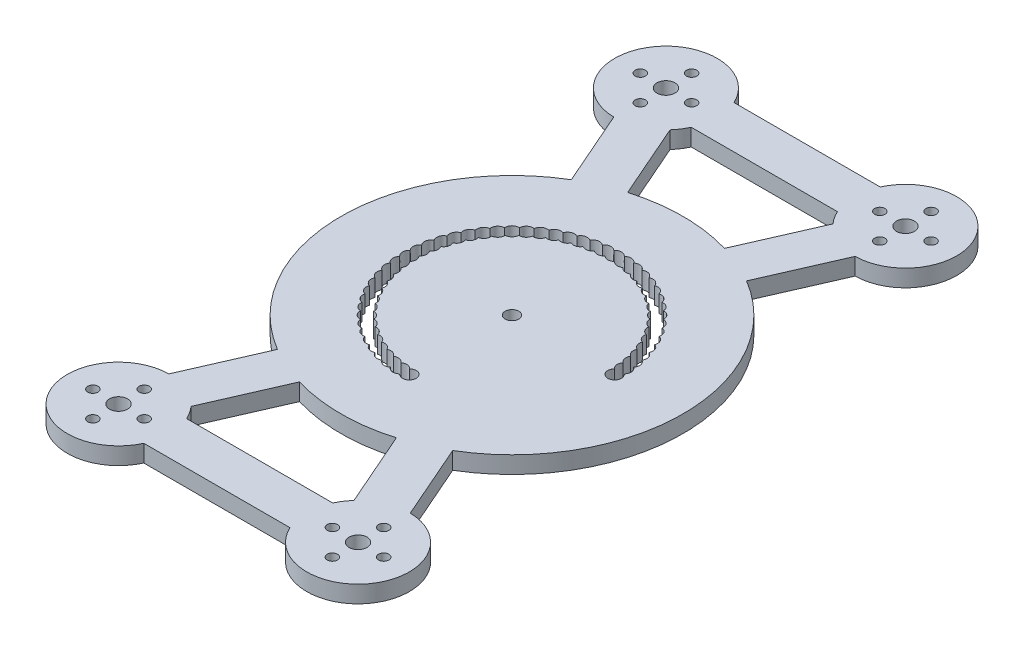
from build123d import *

# Parameters (mm, degrees)
SKETCH1_W           = 100
SKETCH1_H           = 190
BOSS_EXTRUDE1_DEPTH = 5
SKETCH2_R           = 2
CUT_EXTRUDE1_DEPTH  = 108.470926301
SKETCH3_OUTSIDE_W   = 144.954
SKETCH3_OUTSIDE_H   = 234.954
SKETCH3_OUTSIDE_R   = 2.625
SKETCH3_OUTSIDE_R_2 = 1.5
CUT_EXTRUDE2_DEPTH  = 108.470926301


with BuildPart() as part:
    # Sketch1 → Boss-Extrude1 (new body)
    with BuildSketch(Plane(origin=(0, 0, 0), x_dir=(1, 0, 0), z_dir=(0, 1, 0))):
        Rectangle(SKETCH1_W, SKETCH1_H)
    extrude(amount=BOSS_EXTRUDE1_DEPTH)

    # Sketch2 → Cut-Extrude1 (cut, through all)
    with BuildSketch(Plane(origin=(0, 5, 0), x_dir=(1, 0, 0), z_dir=(0, 1, 0))):
        with Locations(Location((0, 0, 0), (0, 0, 270))):
            Circle(SKETCH2_R)
        with BuildLine():
            ThreePointArc((28.575471562, 1.403822899), (30.098135349, -1.997590912), (31.280070238, 1.536691311))
            ThreePointArc((31.280070238, 1.536691311), (31.845911254, 3.136548491), (30.978826062, 4.595274757))
            ThreePointArc((30.978826062, 4.595274757), (31.385128973, 6.242890305), (30.379238856, 7.609603194))
            ThreePointArc((30.379238856, 7.609603194), (30.622090743, 9.289109672), (29.487082974, 10.550646993))
            ThreePointArc((29.487082974, 10.550646993), (29.56414504, 12.245869836), (28.310950363, 13.390082294))
            ThreePointArc((28.310950363, 13.390082294), (28.221480459, 15.084695578), (26.862167823, 16.100563782))
            ThreePointArc((26.862167823, 16.100563782), (26.607027594, 17.778247457), (25.154687923, 18.65598804))
            ThreePointArc((25.154687923, 18.65598804), (24.736334508, 20.300585093), (23.204954628, 21.031744934))
            ThreePointArc((23.204954628, 21.031744934), (22.627416998, 22.627416998), (21.031744934, 23.204954628))
            ThreePointArc((21.031744934, 23.204954628), (20.300585093, 24.736334508), (18.65598804, 25.154687923))
            ThreePointArc((18.65598804, 25.154687923), (17.778247457, 26.607027594), (16.100563782, 26.862167823))
            ThreePointArc((16.100563782, 26.862167823), (15.084695578, 28.221480459), (13.390082294, 28.310950363))
            ThreePointArc((13.390082294, 28.310950363), (12.245869836, 29.56414504), (10.550646993, 29.487082974))
            ThreePointArc((10.550646993, 29.487082974), (9.289109672, 30.622090743), (7.609603194, 30.379238856))
            ThreePointArc((7.609603194, 30.379238856), (6.242890305, 31.385128973), (4.595274757, 30.978826062))
            ThreePointArc((4.595274757, 30.978826062), (3.136548491, 31.845911254), (1.536691311, 31.280070238))
            ThreePointArc((1.536691311, 31.280070238), (0, 32), (-1.536691311, 31.280070238))
            ThreePointArc((-1.536691311, 31.280070238), (-3.136548491, 31.845911254), (-4.595274757, 30.978826062))
            ThreePointArc((-4.595274757, 30.978826062), (-6.242890305, 31.385128973), (-7.609603194, 30.379238856))
            ThreePointArc((-7.609603194, 30.379238856), (-9.289109672, 30.622090743), (-10.550646993, 29.487082974))
            ThreePointArc((-10.550646993, 29.487082974), (-12.245869836, 29.56414504), (-13.390082294, 28.310950363))
            ThreePointArc((-13.390082294, 28.310950363), (-15.084695578, 28.221480459), (-16.100563782, 26.862167823))
            ThreePointArc((-16.100563782, 26.862167823), (-17.778247457, 26.607027594), (-18.65598804, 25.154687923))
            ThreePointArc((-18.65598804, 25.154687923), (-20.300585093, 24.736334508), (-21.031744934, 23.204954628))
            ThreePointArc((-21.031744934, 23.204954628), (-22.627416998, 22.627416998), (-23.204954628, 21.031744934))
            ThreePointArc((-23.204954628, 21.031744934), (-24.736334508, 20.300585093), (-25.154687923, 18.65598804))
            ThreePointArc((-25.154687923, 18.65598804), (-26.607027594, 17.778247457), (-26.862167823, 16.100563782))
            ThreePointArc((-26.862167823, 16.100563782), (-28.221480459, 15.084695578), (-28.310950363, 13.390082294))
            ThreePointArc((-28.310950363, 13.390082294), (-29.56414504, 12.245869836), (-29.487082974, 10.550646993))
            ThreePointArc((-29.487082974, 10.550646993), (-30.622090743, 9.289109672), (-30.379238856, 7.609603194))
            ThreePointArc((-30.379238856, 7.609603194), (-31.385128973, 6.242890305), (-30.978826062, 4.595274757))
            ThreePointArc((-30.978826062, 4.595274757), (-31.845911254, 3.136548491), (-31.280070238, 1.536691311))
            ThreePointArc((-31.280070238, 1.536691311), (-32, 0), (-31.280070238, -1.536691311))
            ThreePointArc((-31.280070238, -1.536691311), (-31.845911254, -3.136548491), (-30.978826062, -4.595274757))
            ThreePointArc((-30.978826062, -4.595274757), (-31.385128973, -6.242890305), (-30.379238856, -7.609603194))
            ThreePointArc((-30.379238856, -7.609603194), (-30.622090743, -9.289109672), (-29.487082974, -10.550646993))
            ThreePointArc((-29.487082974, -10.550646993), (-29.56414504, -12.245869836), (-28.310950363, -13.390082294))
            ThreePointArc((-28.310950363, -13.390082294), (-28.221480459, -15.084695578), (-26.862167823, -16.100563782))
            ThreePointArc((-26.862167823, -16.100563782), (-26.607027594, -17.778247457), (-25.154687923, -18.65598804))
            ThreePointArc((-25.154687923, -18.65598804), (-24.736334508, -20.300585093), (-23.204954628, -21.031744934))
            ThreePointArc((-23.204954628, -21.031744934), (-22.627416998, -22.627416998), (-21.031744934, -23.204954628))
            ThreePointArc((-21.031744934, -23.204954628), (-20.300585093, -24.736334508), (-18.65598804, -25.154687923))
            ThreePointArc((-18.65598804, -25.154687923), (-17.778247457, -26.607027594), (-16.100563782, -26.862167823))
            ThreePointArc((-16.100563782, -26.862167823), (-15.084695578, -28.221480459), (-13.390082294, -28.310950363))
            ThreePointArc((-13.390082294, -28.310950363), (-12.245869836, -29.56414504), (-10.550646993, -29.487082974))
            ThreePointArc((-10.550646993, -29.487082974), (-9.289109672, -30.622090743), (-7.609603194, -30.379238856))
            ThreePointArc((-7.609603194, -30.379238856), (-6.242890305, -31.385128973), (-4.595274757, -30.978826062))
            ThreePointArc((-4.595274757, -30.978826062), (-3.136548491, -31.845911254), (-1.536691311, -31.280070238))
            ThreePointArc((-1.536691311, -31.280070238), (1.997590912, -30.098135349), (-1.403822899, -28.575471562))
            ThreePointArc((-1.403822899, -28.575471562), (-2.744479929, -27.865172347), (-4.197949114, -28.30027415))
            ThreePointArc((-4.197949114, -28.30027415), (-5.462529016, -27.461987851), (-6.951646784, -27.752529628))
            ThreePointArc((-6.951646784, -27.752529628), (-8.127970963, -26.794329401), (-9.638396296, -26.937513074))
            ThreePointArc((-9.638396296, -26.937513074), (-10.715136106, -25.86862691), (-12.232322782, -25.863073543))
            ThreePointArc((-12.232322782, -25.863073543), (-13.199108631, -24.693795402), (-14.708445313, -24.539558476))
            ThreePointArc((-14.708445313, -24.539558476), (-15.555966525, -23.281149144), (-17.042917476, -22.979714046))
            ThreePointArc((-17.042917476, -22.979714046), (-17.763011957, -21.644292694), (-19.213257026, -21.198562409))
            ThreePointArc((-19.213257026, -21.198562409), (-19.798989873, -19.798989873), (-21.198562409, -19.213257026))
            ThreePointArc((-21.198562409, -19.213257026), (-21.644292694, -17.763011957), (-22.979714046, -17.042917476))
            ThreePointArc((-22.979714046, -17.042917476), (-23.281149144, -15.555966525), (-24.539558476, -14.708445313))
            ThreePointArc((-24.539558476, -14.708445313), (-24.693795402, -13.199108631), (-25.863073543, -12.232322782))
            ThreePointArc((-25.863073543, -12.232322782), (-25.86862691, -10.715136106), (-26.937513074, -9.638396296))
            ThreePointArc((-26.937513074, -9.638396296), (-26.794329401, -8.127970963), (-27.752529628, -6.951646784))
            ThreePointArc((-27.752529628, -6.951646784), (-27.461987851, -5.462529016), (-28.30027415, -4.197949114))
            ThreePointArc((-28.30027415, -4.197949114), (-27.865172347, -2.744479929), (-28.575471562, -1.403822899))
            ThreePointArc((-28.575471562, -1.403822899), (-28, 0), (-28.575471562, 1.403822899))
            ThreePointArc((-28.575471562, 1.403822899), (-27.865172347, 2.744479929), (-28.30027415, 4.197949114))
            ThreePointArc((-28.30027415, 4.197949114), (-27.461987851, 5.462529016), (-27.752529628, 6.951646784))
            ThreePointArc((-27.752529628, 6.951646784), (-26.794329401, 8.127970963), (-26.937513074, 9.638396296))
            ThreePointArc((-26.937513074, 9.638396296), (-25.86862691, 10.715136106), (-25.863073543, 12.232322782))
            ThreePointArc((-25.863073543, 12.232322782), (-24.693795402, 13.199108631), (-24.539558476, 14.708445313))
            ThreePointArc((-24.539558476, 14.708445313), (-23.281149144, 15.555966525), (-22.979714046, 17.042917476))
            ThreePointArc((-22.979714046, 17.042917476), (-21.644292694, 17.763011957), (-21.198562409, 19.213257026))
            ThreePointArc((-21.198562409, 19.213257026), (-19.798989873, 19.798989873), (-19.213257026, 21.198562409))
            ThreePointArc((-19.213257026, 21.198562409), (-17.763011957, 21.644292694), (-17.042917476, 22.979714046))
            ThreePointArc((-17.042917476, 22.979714046), (-15.555966525, 23.281149144), (-14.708445313, 24.539558476))
            ThreePointArc((-14.708445313, 24.539558476), (-13.199108631, 24.693795402), (-12.232322782, 25.863073543))
            ThreePointArc((-12.232322782, 25.863073543), (-10.715136106, 25.86862691), (-9.638396296, 26.937513074))
            ThreePointArc((-9.638396296, 26.937513074), (-8.127970963, 26.794329401), (-6.951646784, 27.752529628))
            ThreePointArc((-6.951646784, 27.752529628), (-5.462529016, 27.461987851), (-4.197949114, 28.30027415))
            ThreePointArc((-4.197949114, 28.30027415), (-2.744479929, 27.865172347), (-1.403822899, 28.575471562))
            ThreePointArc((-1.403822899, 28.575471562), (0, 28), (1.403822899, 28.575471562))
            ThreePointArc((1.403822899, 28.575471562), (2.744479929, 27.865172347), (4.197949114, 28.30027415))
            ThreePointArc((4.197949114, 28.30027415), (5.462529016, 27.461987851), (6.951646784, 27.752529628))
            ThreePointArc((6.951646784, 27.752529628), (8.127970963, 26.794329401), (9.638396296, 26.937513074))
            ThreePointArc((9.638396296, 26.937513074), (10.715136106, 25.86862691), (12.232322782, 25.863073543))
            ThreePointArc((12.232322782, 25.863073543), (13.199108631, 24.693795402), (14.708445313, 24.539558476))
            ThreePointArc((14.708445313, 24.539558476), (15.555966525, 23.281149144), (17.042917476, 22.979714046))
            ThreePointArc((17.042917476, 22.979714046), (17.763011957, 21.644292694), (19.213257026, 21.198562409))
            ThreePointArc((19.213257026, 21.198562409), (19.798989873, 19.798989873), (21.198562409, 19.213257026))
            ThreePointArc((21.198562409, 19.213257026), (21.644292694, 17.763011957), (22.979714046, 17.042917476))
            ThreePointArc((22.979714046, 17.042917476), (23.281149144, 15.555966525), (24.539558476, 14.708445313))
            ThreePointArc((24.539558476, 14.708445313), (24.693795402, 13.199108631), (25.863073543, 12.232322782))
            ThreePointArc((25.863073543, 12.232322782), (25.86862691, 10.715136106), (26.937513074, 9.638396296))
            ThreePointArc((26.937513074, 9.638396296), (26.794329401, 8.127970963), (27.752529628, 6.951646784))
            ThreePointArc((27.752529628, 6.951646784), (27.461987851, 5.462529016), (28.30027415, 4.197949114))
            ThreePointArc((28.30027415, 4.197949114), (27.865172347, 2.744479929), (28.575471562, 1.403822899))
        make_face()
    extrude(amount=-CUT_EXTRUDE1_DEPTH, mode=Mode.SUBTRACT)

    # Sketch3 outside → Cut-Extrude2 (cut, through all)
    # profile 1 of 23: a face of its own
    with BuildSketch(Plane(origin=(0, 5, 0), x_dir=(1, 0, 0), z_dir=(0, 1, 0))):
        Rectangle(SKETCH3_OUTSIDE_W, SKETCH3_OUTSIDE_H)
        with BuildLine():
            Line((-35.260461755, 65.002261515), (-25.609738761, 42.943466099))
            ThreePointArc((-25.609738761, 42.943466099), (-50, 0), (-25.609738761, -42.943466099))
            Line((-25.609738761, -42.943466099), (-35.260461755, -65.002261515))
            ThreePointArc((-35.260461755, -65.002261515), (-47.553569963, -88.210230275), (-21.364109857, -86.25))
            Line((-21.364109857, -86.25), (21.364109857, -86.25))
            ThreePointArc((21.364109857, -86.25), (47.553569963, -88.210230275), (35.260461755, -65.002261515))
            Line((35.260461755, -65.002261515), (25.609738761, -42.943466099))
            ThreePointArc((25.609738761, -42.943466099), (50, 0), (25.609738761, 42.943466099))
            Line((25.609738761, 42.943466099), (35.260461755, 65.002261515))
            ThreePointArc((35.260461755, 65.002261515), (47.553569963, 88.210230275), (21.364109857, 86.25))
            Line((21.364109857, 86.25), (-21.364109857, 86.25))
            ThreePointArc((-21.364109857, 86.25), (-47.553569963, 88.210230275), (-35.260461755, 65.002261515))
        make_face(mode=Mode.SUBTRACT)
    # profile 2 of 23: a face of its own
    with BuildSketch(Plane(origin=(0, 5, 0), x_dir=(1, 0, 0), z_dir=(0, 1, 0))):
        with Locations(Location((-35, 80, 0), (0, 0, 270))):
            Circle(SKETCH3_OUTSIDE_R)
    # profile 3 of 23: a face of its own
    with BuildSketch(Plane(origin=(0, 5, 0), x_dir=(1, 0, 0), z_dir=(0, 1, 0))):
        with Locations(Location((-35, 87.5, 0), (0, 0, 270))):
            Circle(SKETCH3_OUTSIDE_R_2)
    # profile 4 of 23: a face of its own
    with BuildSketch(Plane(origin=(0, 5, 0), x_dir=(1, 0, 0), z_dir=(0, 1, 0))):
        with Locations(Location((-27.5, 80, 0), (0, 0, 270))):
            Circle(SKETCH3_OUTSIDE_R_2)
    # profile 5 of 23: a face of its own
    with BuildSketch(Plane(origin=(0, 5, 0), x_dir=(1, 0, 0), z_dir=(0, 1, 0))):
        with Locations(Location((-35, 72.5, 0), (0, 0, 270))):
            Circle(SKETCH3_OUTSIDE_R_2)
    # profile 6 of 23: a face of its own
    with BuildSketch(Plane(origin=(0, 5, 0), x_dir=(1, 0, 0), z_dir=(0, 1, 0))):
        with Locations(Location((-42.5, 80, 0), (0, 0, 270))):
            Circle(SKETCH3_OUTSIDE_R_2)
    # profile 7 of 23: a face of its own
    with BuildSketch(Plane(origin=(0, 5, 0), x_dir=(1, 0, 0), z_dir=(0, 1, 0))):
        with Locations(Location((35, 72.5, 0), (0, 0, 90))):
            Circle(SKETCH3_OUTSIDE_R_2)
    # profile 8 of 23: a face of its own
    with BuildSketch(Plane(origin=(0, 5, 0), x_dir=(1, 0, 0), z_dir=(0, 1, 0))):
        with Locations(Location((42.5, 80, 0), (0, 0, 90))):
            Circle(SKETCH3_OUTSIDE_R_2)
    # profile 9 of 23: a face of its own
    with BuildSketch(Plane(origin=(0, 5, 0), x_dir=(1, 0, 0), z_dir=(0, 1, 0))):
        with Locations(Location((27.5, 80, 0), (0, 0, 90))):
            Circle(SKETCH3_OUTSIDE_R_2)
    # profile 10 of 23: a face of its own
    with BuildSketch(Plane(origin=(0, 5, 0), x_dir=(1, 0, 0), z_dir=(0, 1, 0))):
        with Locations(Location((35, 87.5, 0), (0, 0, 90))):
            Circle(SKETCH3_OUTSIDE_R_2)
    # profile 11 of 23: a face of its own
    with BuildSketch(Plane(origin=(0, 5, 0), x_dir=(1, 0, 0), z_dir=(0, 1, 0))):
        with Locations(Location((35, 80, 0), (0, 0, 90))):
            Circle(SKETCH3_OUTSIDE_R)
    # profile 12 of 23: a face of its own
    with BuildSketch(Plane(origin=(0, 5, 0), x_dir=(1, 0, 0), z_dir=(0, 1, 0))):
        with Locations(Location((-35, -72.5, 0), (0, 0, 90))):
            Circle(SKETCH3_OUTSIDE_R_2)
    # profile 13 of 23: a face of its own
    with BuildSketch(Plane(origin=(0, 5, 0), x_dir=(1, 0, 0), z_dir=(0, 1, 0))):
        with Locations(Location((-42.5, -80, 0), (0, 0, 90))):
            Circle(SKETCH3_OUTSIDE_R_2)
    # profile 14 of 23: a face of its own
    with BuildSketch(Plane(origin=(0, 5, 0), x_dir=(1, 0, 0), z_dir=(0, 1, 0))):
        with Locations(Location((-35, -80, 0), (0, 0, 90))):
            Circle(SKETCH3_OUTSIDE_R)
    # profile 15 of 23: a face of its own
    with BuildSketch(Plane(origin=(0, 5, 0), x_dir=(1, 0, 0), z_dir=(0, 1, 0))):
        with Locations(Location((-35, -87.5, 0), (0, 0, 90))):
            Circle(SKETCH3_OUTSIDE_R_2)
    # profile 16 of 23: a face of its own
    with BuildSketch(Plane(origin=(0, 5, 0), x_dir=(1, 0, 0), z_dir=(0, 1, 0))):
        with Locations(Location((-27.5, -80, 0), (0, 0, 90))):
            Circle(SKETCH3_OUTSIDE_R_2)
    # profile 17 of 23: a face of its own
    with BuildSketch(Plane(origin=(0, 5, 0), x_dir=(1, 0, 0), z_dir=(0, 1, 0))):
        with Locations(Location((27.5, -80, 0), (0, 0, 270))):
            Circle(SKETCH3_OUTSIDE_R_2)
    # profile 18 of 23: a face of its own
    with BuildSketch(Plane(origin=(0, 5, 0), x_dir=(1, 0, 0), z_dir=(0, 1, 0))):
        with Locations(Location((35, -87.5, 0), (0, 0, 270))):
            Circle(SKETCH3_OUTSIDE_R_2)
    # profile 19 of 23: a face of its own
    with BuildSketch(Plane(origin=(0, 5, 0), x_dir=(1, 0, 0), z_dir=(0, 1, 0))):
        with Locations(Location((42.5, -80, 0), (0, 0, 270))):
            Circle(SKETCH3_OUTSIDE_R_2)
    # profile 20 of 23: a face of its own
    with BuildSketch(Plane(origin=(0, 5, 0), x_dir=(1, 0, 0), z_dir=(0, 1, 0))):
        with Locations(Location((35, -80, 0), (0, 0, 270))):
            Circle(SKETCH3_OUTSIDE_R)
    # profile 21 of 23: a face of its own
    with BuildSketch(Plane(origin=(0, 5, 0), x_dir=(1, 0, 0), z_dir=(0, 1, 0))):
        with Locations(Location((35, -72.5, 0), (0, 0, 270))):
            Circle(SKETCH3_OUTSIDE_R_2)
    # profile 22 of 23: a face of its own
    with BuildSketch(Plane(origin=(0, 5, 0), x_dir=(1, 0, 0), z_dir=(0, 1, 0))):
        with BuildLine():
            Line((-23.808495069, 70.01249694), (-14.157772074, 47.953701524))
            ThreePointArc((-14.157772074, 47.953701524), (0, 50), (14.157772074, 47.953701524))
            Line((14.157772074, 47.953701524), (23.808495069, 70.01249694))
            ThreePointArc((23.808495069, 70.01249694), (22.446430037, 71.789769725), (21.364109857, 73.75))
            Line((21.364109857, 73.75), (-21.364109857, 73.75))
            ThreePointArc((-21.364109857, 73.75), (-22.446430037, 71.789769725), (-23.808495069, 70.01249694))
        make_face()
    # profile 23 of 23: a face of its own
    with BuildSketch(Plane(origin=(0, 5, 0), x_dir=(1, 0, 0), z_dir=(0, 1, 0))):
        with BuildLine():
            Line((-23.808495069, -70.01249694), (-14.157772074, -47.953701524))
            ThreePointArc((-14.157772074, -47.953701524), (0, -50), (14.157772074, -47.953701524))
            Line((14.157772074, -47.953701524), (23.808495069, -70.01249694))
            ThreePointArc((23.808495069, -70.01249694), (22.446430037, -71.789769725), (21.364109857, -73.75))
            Line((21.364109857, -73.75), (-21.364109857, -73.75))
            ThreePointArc((-21.364109857, -73.75), (-22.446430037, -71.789769725), (-23.808495069, -70.01249694))
        make_face()
    extrude(amount=-CUT_EXTRUDE2_DEPTH, mode=Mode.SUBTRACT)


solid = part.part
